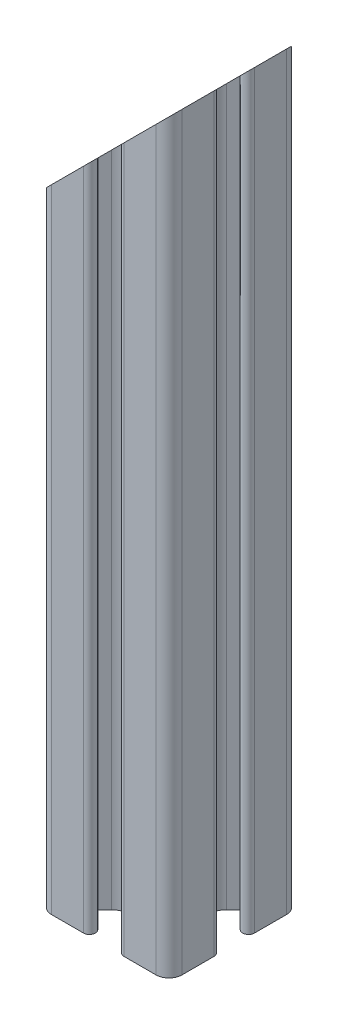
from build123d import *

# Parameters (mm, degrees)
EXTRUDE_1_DEPTH     = 115
CUT_EXTRUDE_1_DEPTH = 118.951465627


with BuildPart() as part:
    # 草图1 → 凸台-拉伸1 (new body)
    with BuildSketch(Plane(origin=(0, 0, 0), x_dir=(1, 0, 0), z_dir=(0, 1, 0))):
        with BuildLine():
            Line((-1.042752475, -10.085861632), (3.857247525, -10.085861632))
            ThreePointArc((3.857247525, -10.085861632), (4.757247525, -10.985861632), (3.857247525, -11.885861632))
            Line((3.857247525, -11.885861632), (1.076161722, -11.885861632))
            ThreePointArc((1.076161722, -11.885861632), (0.722608332, -12.032308241), (0.576161722, -12.385861632))
            Line((0.576161722, -12.385861632), (0.576161722, -12.790788968))
            ThreePointArc((0.576161722, -12.790788968), (0.614221956, -12.982130685), (0.722608332, -13.144342359))
            Line((0.722608332, -13.144342359), (2.885447948, -15.307181975))
            ThreePointArc((2.885447948, -15.307181975), (3.858717994, -15.957500229), (5.006768291, -16.185861632))
            Line((5.006768291, -16.185861632), (8.907726758, -16.185861632))
            ThreePointArc((8.907726758, -16.185861632), (10.055777055, -15.957500229), (11.029047102, -15.307181975))
            Line((11.029047102, -15.307181975), (13.191886718, -13.144342359))
            ThreePointArc((13.191886718, -13.144342359), (13.300273094, -12.982130685), (13.338333327, -12.790788968))
            Line((13.338333327, -12.790788968), (13.338333327, -12.385861632))
            ThreePointArc((13.338333327, -12.385861632), (13.191886718, -12.032308241), (12.838333327, -11.885861632))
            Line((12.838333327, -11.885861632), (10.057247525, -11.885861632))
            ThreePointArc((10.057247525, -11.885861632), (9.157247525, -10.985861632), (10.057247525, -10.085861632))
            Line((10.057247525, -10.085861632), (14.957247525, -10.085861632))
            ThreePointArc((14.957247525, -10.085861632), (16.371461087, -10.671648069), (16.957247525, -12.085861632))
            Line((16.957247525, -12.085861632), (16.957247525, -16.985861632))
            ThreePointArc((16.957247525, -16.985861632), (16.057247525, -17.885861632), (15.157247525, -16.985861632))
            Line((15.157247525, -16.985861632), (15.157247525, -14.204775829))
            ThreePointArc((15.157247525, -14.204775829), (15.010800915, -13.851222438), (14.657247525, -13.704775829))
            Line((14.657247525, -13.704775829), (14.252320188, -13.704775829))
            ThreePointArc((14.252320188, -13.704775829), (14.060978472, -13.742836063), (13.898766797, -13.851222438))
            Line((13.898766797, -13.851222438), (11.735927181, -16.014062054))
            ThreePointArc((11.735927181, -16.014062054), (11.085608927, -16.987332101), (10.857247525, -18.135382398))
            Line((10.857247525, -18.135382398), (10.857247525, -22.036340865))
            ThreePointArc((10.857247525, -22.036340865), (11.085608927, -23.184391162), (11.735927181, -24.157661209))
            Line((11.735927181, -24.157661209), (13.898766797, -26.320500825))
            ThreePointArc((13.898766797, -26.320500825), (14.060978472, -26.4288872), (14.252320188, -26.466947434))
            Line((14.252320188, -26.466947434), (14.657247525, -26.466947434))
            ThreePointArc((14.657247525, -26.466947434), (15.010800915, -26.320500825), (15.157247525, -25.966947434))
            Line((15.157247525, -25.966947434), (15.157247525, -23.185861632))
            ThreePointArc((15.157247525, -23.185861632), (16.057247525, -22.285861632), (16.957247525, -23.185861632))
            Line((16.957247525, -23.185861632), (16.957247525, -28.085861632))
            ThreePointArc((16.957247525, -28.085861632), (16.371461087, -29.500075194), (14.957247525, -30.085861632))
            Line((14.957247525, -30.085861632), (10.057247525, -30.085861632))
            ThreePointArc((10.057247525, -30.085861632), (9.157247525, -29.185861632), (10.057247525, -28.285861632))
            Line((10.057247525, -28.285861632), (12.838333327, -28.285861632))
            ThreePointArc((12.838333327, -28.285861632), (13.191886718, -28.139415022), (13.338333327, -27.785861632))
            Line((13.338333327, -27.785861632), (13.338333327, -27.380934295))
            ThreePointArc((13.338333327, -27.380934295), (13.300273094, -27.189592579), (13.191886718, -27.027380904))
            Line((13.191886718, -27.027380904), (11.029047102, -24.864541288))
            ThreePointArc((11.029047102, -24.864541288), (10.055777055, -24.214223034), (8.907726758, -23.985861632))
            Line((8.907726758, -23.985861632), (5.006768291, -23.985861632))
            ThreePointArc((5.006768291, -23.985861632), (3.858717994, -24.214223034), (2.885447948, -24.864541288))
            Line((2.885447948, -24.864541288), (0.722608332, -27.027380904))
            ThreePointArc((0.722608332, -27.027380904), (0.614221956, -27.189592579), (0.576161722, -27.380934295))
            Line((0.576161722, -27.380934295), (0.576161722, -27.785861632))
            ThreePointArc((0.576161722, -27.785861632), (0.722608332, -28.139415022), (1.076161722, -28.285861632))
            Line((1.076161722, -28.285861632), (3.857247525, -28.285861632))
            ThreePointArc((3.857247525, -28.285861632), (4.757247525, -29.185861632), (3.857247525, -30.085861632))
            Line((3.857247525, -30.085861632), (-1.042752475, -30.085861632))
            ThreePointArc((-1.042752475, -30.085861632), (-2.456966038, -29.500075194), (-3.042752475, -28.085861632))
            Line((-3.042752475, -28.085861632), (-3.042752475, -23.185861632))
            ThreePointArc((-3.042752475, -23.185861632), (-2.142752475, -22.285861632), (-1.242752475, -23.185861632))
            Line((-1.242752475, -23.185861632), (-1.242752475, -25.966947434))
            ThreePointArc((-1.242752475, -25.966947434), (-1.096305866, -26.320500825), (-0.742752475, -26.466947434))
            Line((-0.742752475, -26.466947434), (-0.337825138, -26.466947434))
            ThreePointArc((-0.337825138, -26.466947434), (-0.146483422, -26.4288872), (0.015728252, -26.320500825))
            Line((0.015728252, -26.320500825), (2.178567868, -24.157661209))
            ThreePointArc((2.178567868, -24.157661209), (2.828886122, -23.184391162), (3.057247525, -22.036340865))
            Line((3.057247525, -22.036340865), (3.057247525, -18.135382398))
            ThreePointArc((3.057247525, -18.135382398), (2.828886122, -16.987332101), (2.178567868, -16.014062054))
            Line((2.178567868, -16.014062054), (0.015728252, -13.851222438))
            ThreePointArc((0.015728252, -13.851222438), (-0.146483422, -13.742836063), (-0.337825138, -13.704775829))
            Line((-0.337825138, -13.704775829), (-0.742752475, -13.704775829))
            ThreePointArc((-0.742752475, -13.704775829), (-1.096305866, -13.851222438), (-1.242752475, -14.204775829))
            Line((-1.242752475, -14.204775829), (-1.242752475, -16.985861632))
            ThreePointArc((-1.242752475, -16.985861632), (-2.142752475, -17.885861632), (-3.042752475, -16.985861632))
            Line((-3.042752475, -16.985861632), (-3.042752475, -12.085861632))
            ThreePointArc((-3.042752475, -12.085861632), (-2.456966038, -10.671648069), (-1.042752475, -10.085861632))
        make_face()
    extrude(amount=EXTRUDE_1_DEPTH)

    # 草图2 → 切除-拉伸1 (cut, through all)
    with BuildSketch(Plane.XY.offset(30.085861632)):
        Polygon((16.957247525, 115), (-3.042752475, 95), (-3.042752475, 115), align=None)
    extrude(amount=-CUT_EXTRUDE_1_DEPTH, mode=Mode.SUBTRACT)


solid = part.part
